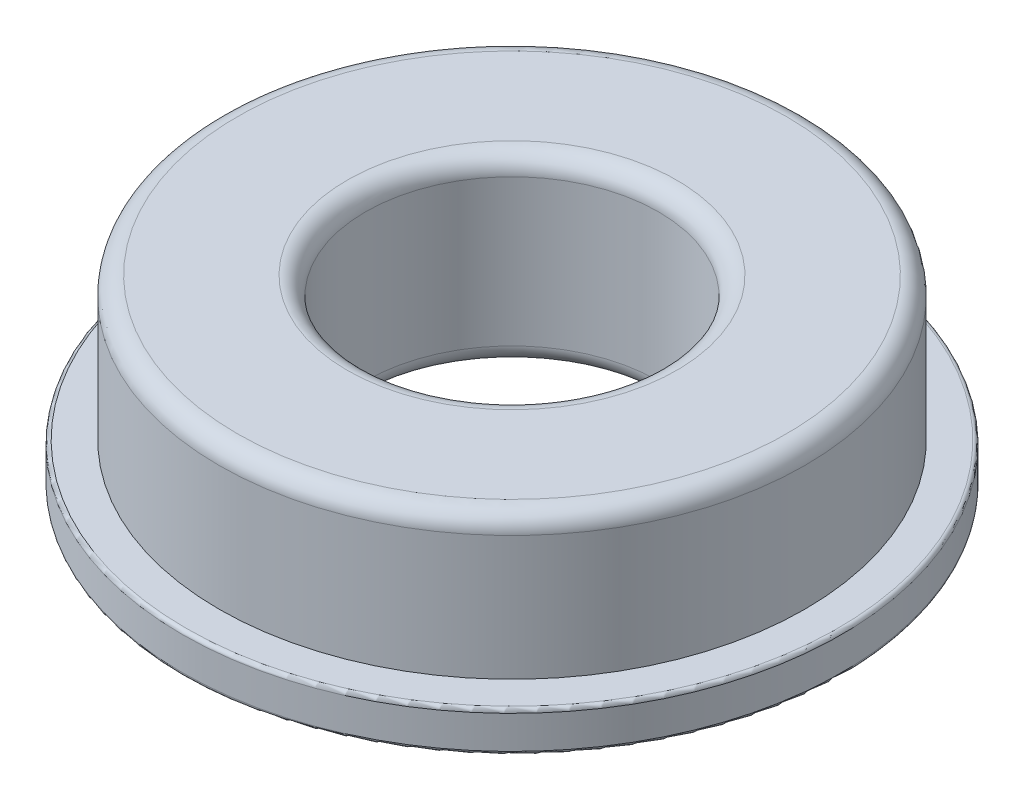
from build123d import *

# Parameters (mm, degrees)
SKETCH1_R           = 9
BOSS_EXTRUDE1_DEPTH = 5
CUT_EXTRUDE1_START  = -3.9
SKETCH2_R           = 9
SKETCH2_R_2         = 8
CUT_EXTRUDE1_DEPTH  = 3.9
SKETCH3_R           = 4
CUT_EXTRUDE2_DEPTH  = 5
FILLET1_R           = 0.5
FILLET2_R           = 0.1
FILLET3_R           = 0.1


with BuildPart() as part:
    # Sketch1 → Boss-Extrude1 (new body)
    with BuildSketch(Plane(origin=(0, 0, 0), x_dir=(1, 0, 0), z_dir=(0, 1, 0))):
        with Locations(Location((0, 0, 0), (0, 0, 270))):
            Circle(SKETCH1_R)
    extrude(amount=BOSS_EXTRUDE1_DEPTH)

    # Sketch2 → Cut-Extrude1 (cut)
    with BuildSketch(Plane(origin=(0, 5, 0), x_dir=(1, 0, 0), z_dir=(0, 1, 0)).offset(CUT_EXTRUDE1_START)):
        with Locations(Location((0, 0, 0), (0, 0, 270))):
            Circle(SKETCH2_R)
        with Locations(Location((0, 0, 0), (0, 0, 270))):
            Circle(SKETCH2_R_2, mode=Mode.SUBTRACT)
    extrude(amount=CUT_EXTRUDE1_DEPTH, mode=Mode.SUBTRACT)

    # Sketch3 → Cut-Extrude2 (cut)
    with BuildSketch(Plane(origin=(0, 5, 0), x_dir=(1, 0, 0), z_dir=(0, 1, 0))):
        with Locations(Location((0, 0, 0), (0, 0, 270))):
            Circle(SKETCH3_R)
    extrude(amount=-CUT_EXTRUDE2_DEPTH, mode=Mode.SUBTRACT)

    # Fillet1
    fillet1_edges = [part.edges().sort_by_distance(p)[0] for p in [
        (0, 0, -4),
        (0, 5, -4),
        (0, 5, -8),
    ]]
    fillet(fillet1_edges, radius=FILLET1_R)

    # Fillet2
    fillet2_edges = [part.edges().sort_by_distance(p)[0] for p in [
        (0, 1.1, -9),
    ]]
    fillet(fillet2_edges, radius=FILLET2_R)

    # Fillet3
    fillet3_edges = [part.edges().sort_by_distance(p)[0] for p in [
        (0, 0, -9),
    ]]
    fillet(fillet3_edges, radius=FILLET3_R)


solid = part.part
